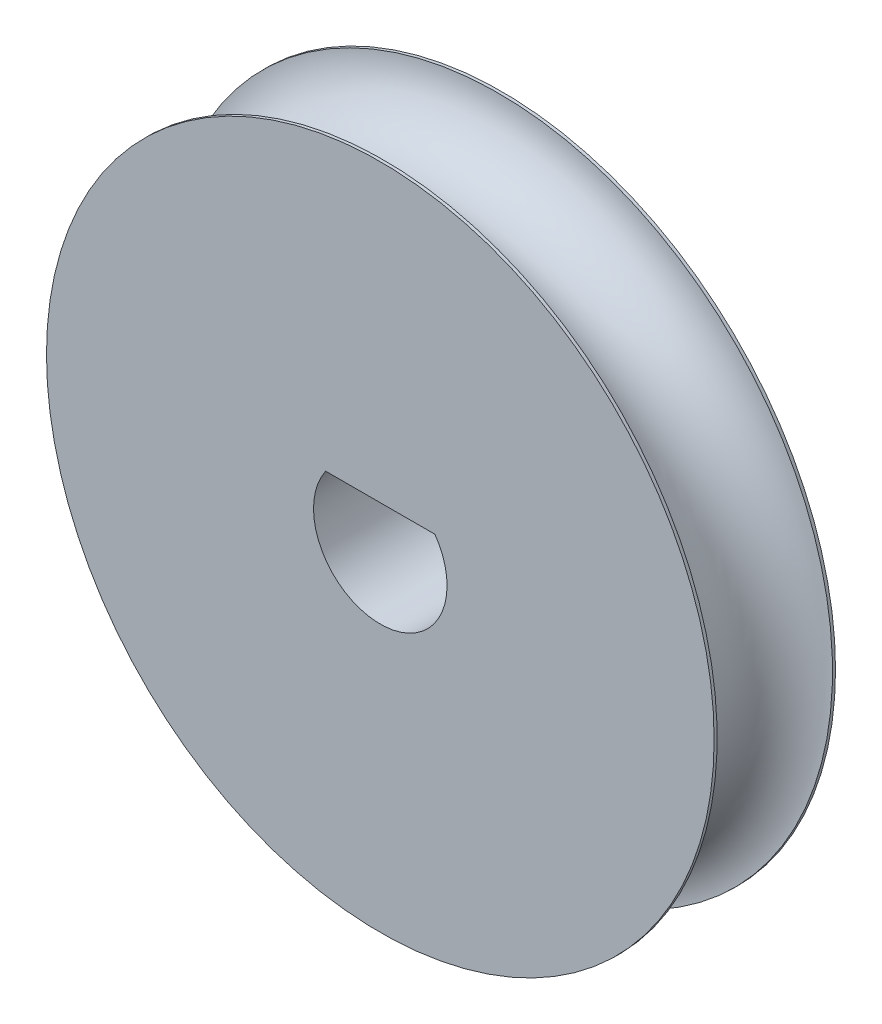
from build123d import *

# Parameters (mm, degrees)
SKETCH1_R           = 5.5
SKETCH1_R_2         = 1.1
BOSS_EXTRUDE1_DEPTH = 2
BOSS_EXTRUDE3_START = -2
BOSS_EXTRUDE3_DEPTH = 2


with BuildPart() as part:
    # Sketch1 → Boss-Extrude1 (new body)
    with BuildSketch(Plane.XY):
        Circle(SKETCH1_R)
        Circle(SKETCH1_R_2, mode=Mode.SUBTRACT)
    extrude(amount=BOSS_EXTRUDE1_DEPTH)

    # Sketch2 → Boss-Extrude3 (add)
    with BuildSketch(Plane.XY.offset(2).offset(BOSS_EXTRUDE3_START)):
        with BuildLine():
            Line((-0.9, 0.632455532), (0.9, 0.632455532))
            ThreePointArc((0.9, 0.632455532), (0, 1.1), (-0.9, 0.632455532))
        make_face()
    extrude(amount=BOSS_EXTRUDE3_DEPTH)

    # Sketch3 → Cut-Revolve1 (revolve, cut)
    with BuildSketch(Plane(origin=(0, 0, 0), x_dir=(0, 0, -1), z_dir=(1, 0, 0)), mode=Mode.PRIVATE) as cut_revolve1_sk:
        with BuildLine():
            Line((-0.05, 5.5), (-1.95, 5.5))
            ThreePointArc((-1.95, 5.5), (-1, 4.55), (-0.05, 5.5))
        make_face()
    revolve(cut_revolve1_sk.sketch.rotate(Axis((0, 0, -0.1), (0, 0, 1)), 90), axis=Axis((0, 0, -0.1), (0, 0, 1)), mode=Mode.SUBTRACT)


solid = part.part
